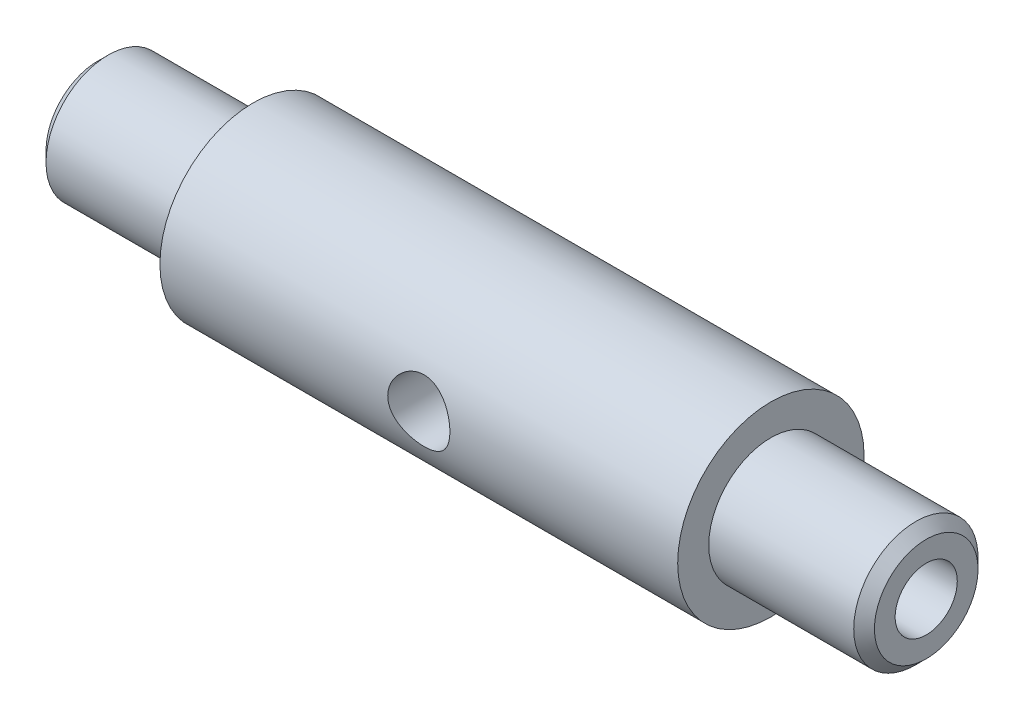
from build123d import *

# Parameters (mm, degrees)
CUT_EXTRUDE2_DEPTH      = 22
CUT_EXTRUDE2_DEPTH_BACK = 21
SKETCH2_R               = 3
SKETCH3_R               = 3
CUT_EXTRUDE3_DEPTH      = 45


with BuildPart() as part:
    # Sketch1 → Revolve1 (revolve)
    with BuildSketch(Plane.XY, mode=Mode.PRIVATE) as revolve1_sk:
        Polygon((-40, 0), (40, 0), (40, 5), (39, 6), (25, 6), (25, 9), (-25, 9), (-25, 6), (-39, 6), (-40, 5), align=None)
    revolve(revolve1_sk.sketch.rotate(Axis((-40, 0, 0), (1, 0, 0)), 90), axis=Axis((-40, 0, 0), (1, 0, 0)))

    # Sketch2 → Cut-Extrude2 (cut, two sides: drawn at the far end of the back side and taken through both)
    with BuildSketch(Plane.XY.offset(-CUT_EXTRUDE2_DEPTH_BACK)):
        with Locations(Location((0, 0, 0), (0, 0, 180))):
            Circle(SKETCH2_R)
    extrude(amount=CUT_EXTRUDE2_DEPTH + CUT_EXTRUDE2_DEPTH_BACK, mode=Mode.SUBTRACT)

    # Sketch3 → Cut-Extrude3 (cut)
    with BuildSketch(Plane(origin=(40, 0, 0), x_dir=(0, 0, -1), z_dir=(1, 0, 0))):
        Circle(SKETCH3_R)
    extrude(amount=-CUT_EXTRUDE3_DEPTH, mode=Mode.SUBTRACT)


solid = part.part
